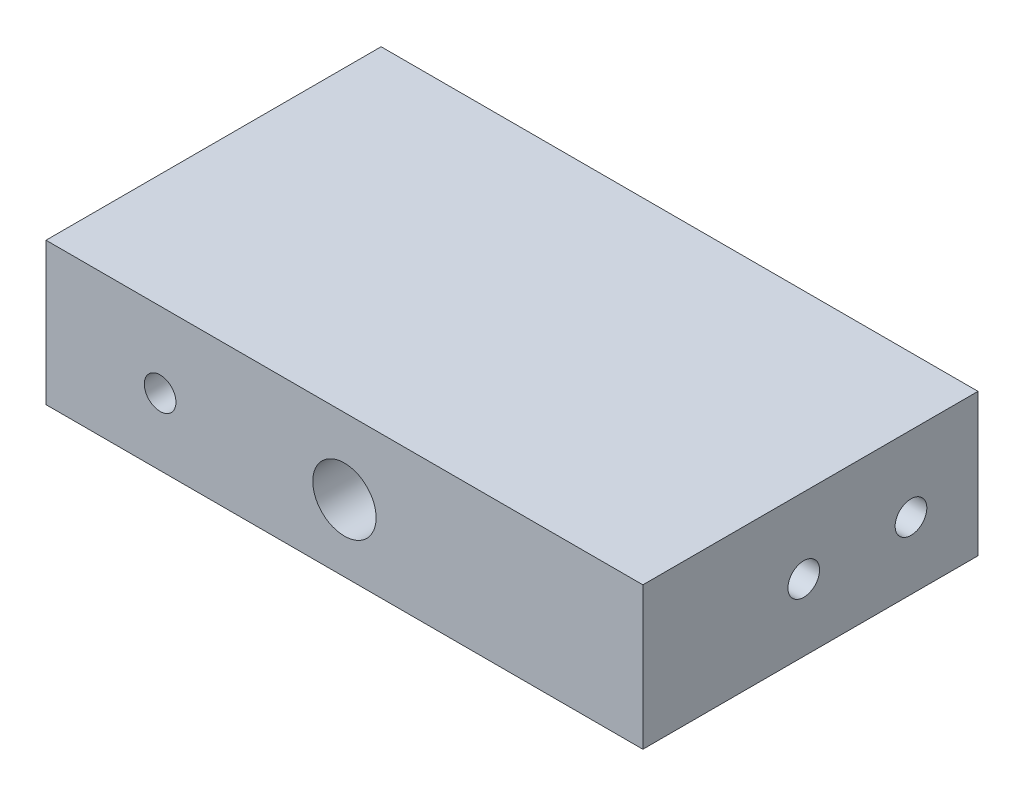
from build123d import *

# Parameters (mm, degrees)
SKETCH1_W           = 56.55
SKETCH1_H           = 12.7
BOSS_EXTRUDE1_DEPTH = 31.75
SKETCH2_R           = 1.5
SKETCH2_R_2         = 3
CUT_EXTRUDE1_DEPTH  = 10
CUT_EXTRUDE2_DEPTH  = 8
SKETCH4_W           = 56.55
SKETCH4_H           = 31.75
BOSS_EXTRUDE2_DEPTH = 0.79375


with BuildPart() as part:
    # Sketch1 → Boss-Extrude1 (new body)
    with BuildSketch(Plane.XY):
        Rectangle(SKETCH1_W, SKETCH1_H)
    extrude(amount=BOSS_EXTRUDE1_DEPTH)

    # Sketch2 → Cut-Extrude1 (cut)
    with BuildSketch(Plane.XY.offset(31.75)):
        with Locations((-17.4625, 0)):
            Circle(SKETCH2_R)
        Circle(SKETCH2_R_2)
    extrude(amount=-CUT_EXTRUDE1_DEPTH, mode=Mode.SUBTRACT)

    # Sketch3 → Cut-Extrude2 (cut)
    with BuildSketch(Plane.ZY.offset(28.275)):
        with BuildLine():
            ThreePointArc((4.85, 0), (6.35, -1.5), (7.85, 0))
            Line((7.85, 0), (4.85, 0))
        make_face()
        with BuildLine():
            Line((4.85, 0), (7.85, 0))
            ThreePointArc((7.85, 0), (6.35, 1.5), (4.85, 0))
        make_face()
        with BuildLine():
            ThreePointArc((15.01, 0), (16.51, -1.5), (18.01, 0))
            Line((18.01, 0), (15.01, 0))
        make_face()
        with BuildLine():
            Line((15.01, 0), (18.01, 0))
            ThreePointArc((18.01, 0), (16.51, 1.5), (15.01, 0))
        make_face()
    cut_extrude2 = extrude(amount=-CUT_EXTRUDE2_DEPTH, mode=Mode.SUBTRACT)

    # Sketch4 → Boss-Extrude2 (add)
    with BuildSketch(Plane(origin=(0, 6.35, 0), x_dir=(1, 0, 0), z_dir=(0, 1, 0))):
        with Locations((0, -15.875)):
            Rectangle(SKETCH4_W, SKETCH4_H)
    extrude(amount=BOSS_EXTRUDE2_DEPTH)

    # Mirror1: Cut-Extrude2 across plane
    add(cut_extrude2.mirror(Plane(origin=(0, 0, 0), x_dir=(0, 0, 1), z_dir=(1, 0, 0))), mode=Mode.SUBTRACT)


solid = part.part
